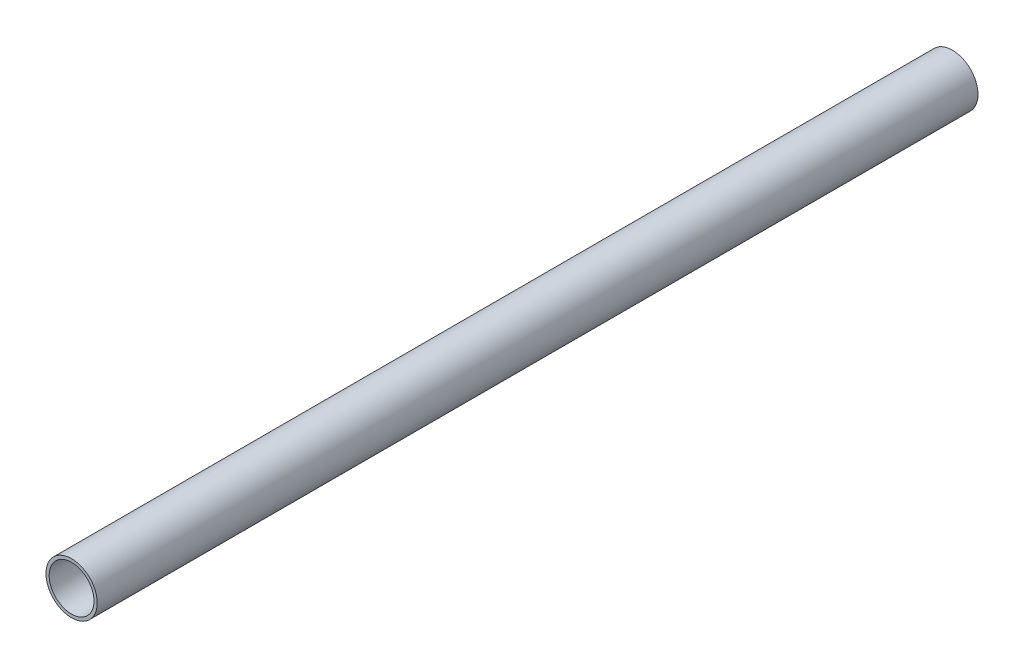
from build123d import *

# Parameters (mm, degrees)
SKETCH1_R               = 8
SKETCH2_R               = 8
CUT_EXTRUDE1_DEPTH      = 276.232628985
CUT_EXTRUDE1_DEPTH_BACK = 276.232628985
SKETCH3_R               = 7


with BuildPart() as part:
    # Sketch1 → Loft1 section 0
    with BuildSketch(Plane.XY):
        Circle(SKETCH1_R)
    # Sketch2 → Loft1 section 1
    with BuildSketch(Plane.XY.offset(275)):
        Circle(SKETCH2_R)
    loft()

    # Sketch3 → Cut-Extrude1 (cut, two sides: drawn at the far end of the back side and taken through both)
    with BuildSketch(Plane.XY.offset(-CUT_EXTRUDE1_DEPTH_BACK)):
        Circle(SKETCH3_R)
    extrude(amount=CUT_EXTRUDE1_DEPTH + CUT_EXTRUDE1_DEPTH_BACK, mode=Mode.SUBTRACT)


solid = part.part
